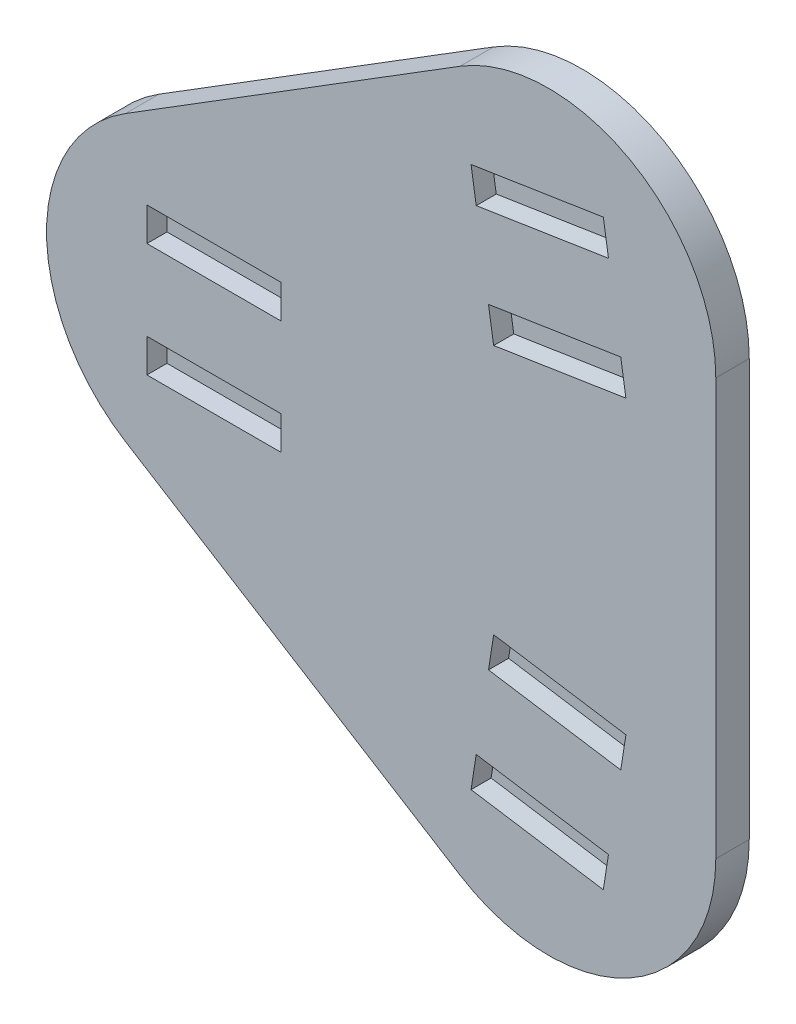
from build123d import *

# Parameters (mm, degrees)
IZIM1_R                     = 65
IZIM1_W                     = 20
IZIM1_H                     = 5
Y_KSEKLIK_EKSTR_ZYON1_DEPTH = 3
Y_KSEKLIK_EKSTR_ZYON2_START = 2
IZIM2_R                     = 65
Y_KSEKLIK_EKSTR_ZYON2_DEPTH = 2
SKETCH1_OUTSIDE_W           = 168.784
SKETCH1_OUTSIDE_H           = 168.784
CUT_EXTRUDE1_DEPTH          = 10


with BuildPart() as part:
    # Çizim1 → Yükseklik-Ekstrüzyon1 (new body)
    with BuildSketch(Plane.XY):
        Circle(IZIM1_R)
        Polygon((6.197521384, -35.508725619), (5.430030224, -40.449470231), (25.193008671, -43.519434871), (25.960499832, -38.578690259), (16.079010608, -37.043707939), align=None, mode=Mode.SUBTRACT)
        Polygon((8.806991329, -18.710193939), (8.039500168, -23.650938551), (17.920989392, -25.185920871), (27.802478616, -26.720903191), (28.569969776, -21.780158579), align=None, mode=Mode.SUBTRACT)
        with Locations((-33, -8.5)):
            Rectangle(IZIM1_W, IZIM1_H, mode=Mode.SUBTRACT)
        with Locations((-33, 8.5)):
            Rectangle(IZIM1_W, IZIM1_H, mode=Mode.SUBTRACT)
        Polygon((17.920989392, 25.185920871), (8.039500168, 23.650938551), (8.806991329, 18.710193939), (28.569969776, 21.780158579), (27.802478616, 26.720903191), align=None, mode=Mode.SUBTRACT)
        Polygon((16.079010608, 37.043707939), (25.960499832, 38.578690259), (25.193008671, 43.519434871), (5.430030224, 40.449470231), (6.197521384, 35.508725619), align=None, mode=Mode.SUBTRACT)
    extrude(amount=Y_KSEKLIK_EKSTR_ZYON1_DEPTH)

    # Çizim2 → Yükseklik-Ekstrüzyon2 (add)
    with BuildSketch(Plane(origin=(0, 0, 0), x_dir=(-1, 0, 0), z_dir=(0, 0, -1)).offset(Y_KSEKLIK_EKSTR_ZYON2_START)):
        Circle(IZIM2_R)
    extrude(amount=-Y_KSEKLIK_EKSTR_ZYON2_DEPTH)

    # Sketch1 outside → Cut-Extrude1 (cut)
    with BuildSketch(Plane.XY.offset(3)):
        Rectangle(SKETCH1_OUTSIDE_W, SKETCH1_OUTSIDE_H)
        with BuildLine():
            Line((-46.208680474, -21.225709885), (3.791319526, -52.34052429))
            ThreePointArc((3.791319526, -52.34052429), (29.140489861, -52.969070419), (42, -31.114814405))
            Line((42, -31.114814405), (42, 31.114814405))
            ThreePointArc((42, 31.114814405), (29.140489861, 52.969070419), (3.791319526, 52.34052429))
            Line((3.791319526, 52.34052429), (-46.208680474, 21.225709885))
            ThreePointArc((-46.208680474, 21.225709885), (-58, 0), (-46.208680474, -21.225709885))
        make_face(mode=Mode.SUBTRACT)
    extrude(amount=-CUT_EXTRUDE1_DEPTH, mode=Mode.SUBTRACT)


solid = part.part
